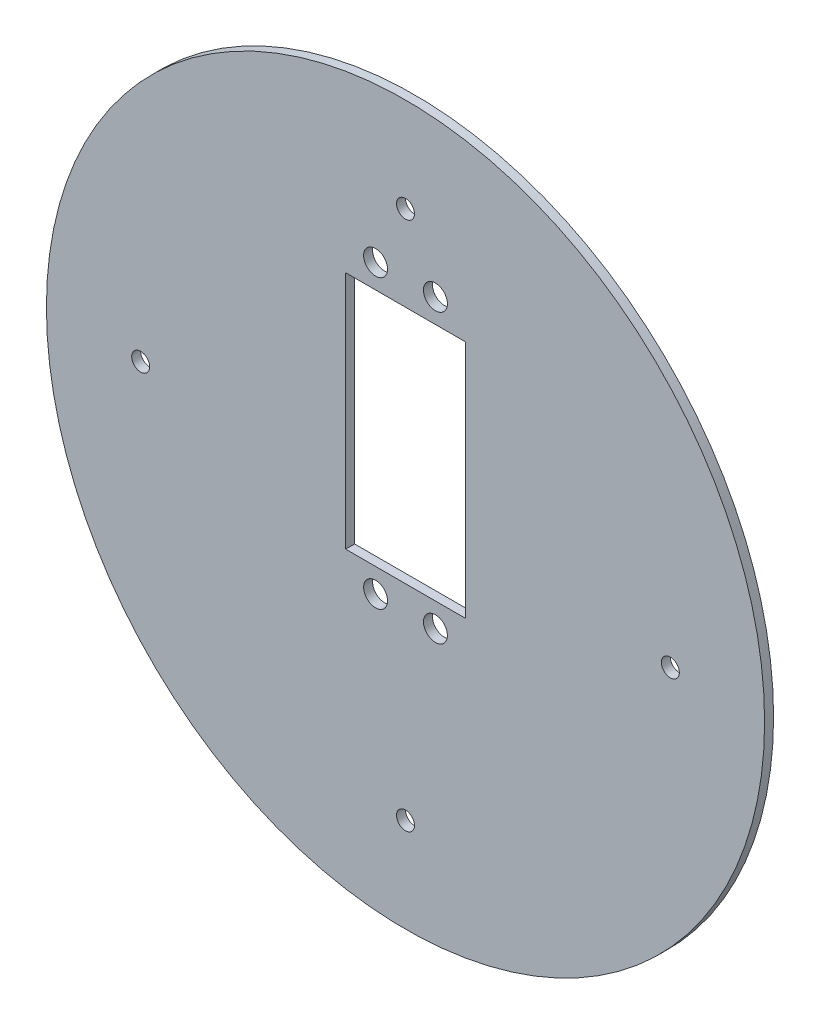
from build123d import *

# Parameters (mm, degrees)
SKETCH_1_R      = 60
SKETCH_1_R_2    = 2
SKETCH_1_R_3    = 1.5
SKETCH_1_W      = 20
SKETCH_1_H      = 40
EXTRUDE_1_DEPTH = 1.5


with BuildPart() as part:
    # 草图1 → 凸台-拉伸1 (new body)
    with BuildSketch(Plane.XY):
        Circle(SKETCH_1_R)
        with Locations((5, 34)):
            Circle(SKETCH_1_R_2, mode=Mode.SUBTRACT)
        with Locations((-5, 34)):
            Circle(SKETCH_1_R_2, mode=Mode.SUBTRACT)
        with Locations((5, -14)):
            Circle(SKETCH_1_R_2, mode=Mode.SUBTRACT)
        with Locations((-5, -14)):
            Circle(SKETCH_1_R_2, mode=Mode.SUBTRACT)
        with Locations((0, 44.25)):
            Circle(SKETCH_1_R_3, mode=Mode.SUBTRACT)
        with Locations((44.25, 0)):
            Circle(SKETCH_1_R_3, mode=Mode.SUBTRACT)
        with Locations((0, -44.25)):
            Circle(SKETCH_1_R_3, mode=Mode.SUBTRACT)
        with Locations((-44.25, 0)):
            Circle(SKETCH_1_R_3, mode=Mode.SUBTRACT)
        with Locations((0, 10)):
            Rectangle(SKETCH_1_W, SKETCH_1_H, mode=Mode.SUBTRACT)
    extrude(amount=EXTRUDE_1_DEPTH)


solid = part.part
